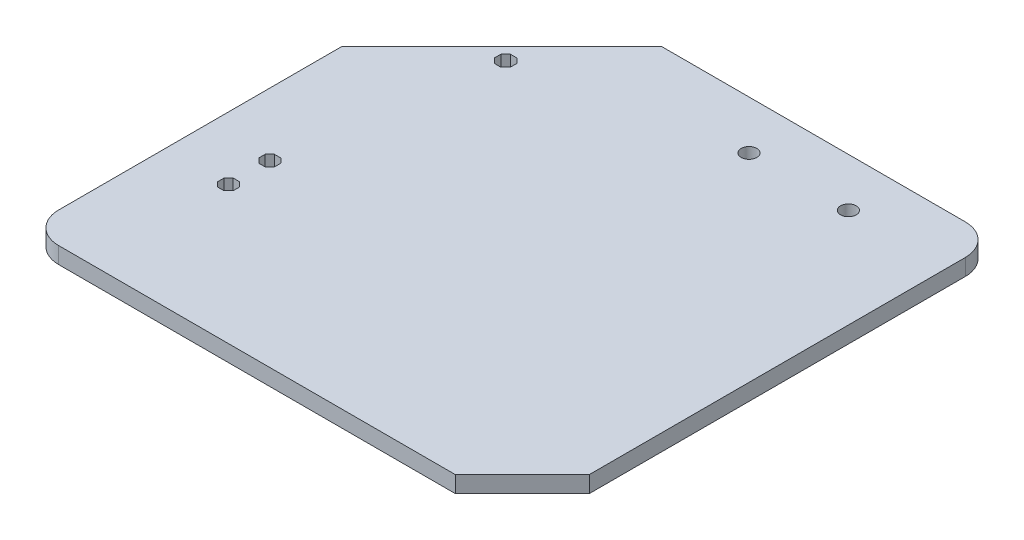
from build123d import *

# Parameters (mm, degrees)
SKETCH2_R           = 0.381
BOSS_EXTRUDE1_DEPTH = 0.8


with BuildPart() as part:
    # Sketch2 → Boss-Extrude1 (new body)
    with BuildSketch(Plane(origin=(0, 0, 0), x_dir=(1, 0, 0), z_dir=(0, 1, 0))):
        with BuildLine():
            Line((7.75, 27.75), (0, 20))
            Line((0, 20), (0, 6.25))
            ThreePointArc((0, 6.25), (0.439339828, 5.189339828), (1.5, 4.75))
            Line((1.5, 4.75), (20.75, 4.75))
            Line((20.75, 4.75), (24, 8))
            Line((24, 8), (24, 26.25))
            ThreePointArc((24, 26.25), (23.560660172, 27.310660172), (22.5, 27.75))
            Line((22.5, 27.75), (7.75, 27.75))
        make_face()
        Polygon((3.4258, 11.28943968), (3.20456032, 11.0682), (2.89143968, 11.0682), (2.6702, 11.28943968), (2.6702, 11.60256032), (2.89143968, 11.8238), (3.20456032, 11.8238), (3.4258, 11.60256032), align=None, mode=Mode.SUBTRACT)
        Polygon((3.4258, 13.28943968), (3.20456032, 13.0682), (2.89143968, 13.0682), (2.6702, 13.28943968), (2.6702, 13.60256032), (2.89143968, 13.8238), (3.20456032, 13.8238), (3.4258, 13.60256032), align=None, mode=Mode.SUBTRACT)
        Polygon((4.41108848, 22.9797), (4.1837, 23.20708848), (4.1837, 23.52891152), (4.41108848, 23.7563), (4.73291152, 23.7563), (4.9603, 23.52891152), (4.9603, 23.20708848), (4.73291152, 22.9797), align=None, mode=Mode.SUBTRACT)
        with Locations((14.355, 25.396)):
            Circle(SKETCH2_R, mode=Mode.SUBTRACT)
        with Locations((19.181, 25.396)):
            Circle(SKETCH2_R, mode=Mode.SUBTRACT)
    extrude(amount=BOSS_EXTRUDE1_DEPTH)


solid = part.part
